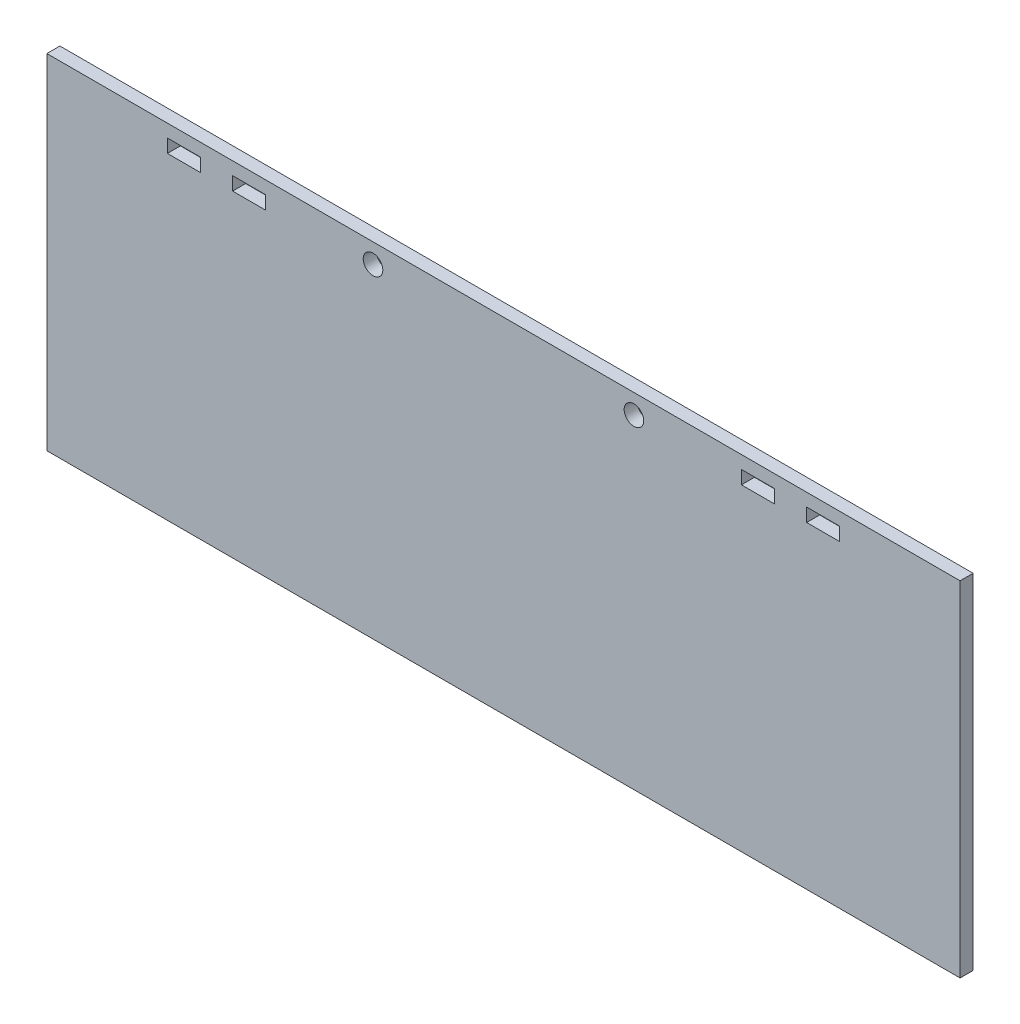
from build123d import *

# Parameters (mm, degrees)
SKETCH_1_R      = 1.5
SKETCH_1_W      = 5.05
SKETCH_1_H      = 2.05
EXTRUDE_1_DEPTH = 2


with BuildPart() as part:
    # 草图1 → 凸台-拉伸1 (new body)
    with BuildSketch(Plane.XY):
        Polygon((54.275, 1.975), (-15.725, 1.975), (-15.725, -50.760914608), (124.275, -50.760914608), (124.275, 1.975), align=None)
        with Locations((34.275, -1.025)):
            Circle(SKETCH_1_R, mode=Mode.SUBTRACT)
        with Locations((74.275, -1.025)):
            Circle(SKETCH_1_R, mode=Mode.SUBTRACT)
        with Locations((15.275, -1.025)):
            Rectangle(SKETCH_1_W, SKETCH_1_H, mode=Mode.SUBTRACT)
        with Locations((5.275, -1.025)):
            Rectangle(SKETCH_1_W, SKETCH_1_H, mode=Mode.SUBTRACT)
        with Locations((103.275, -1.025)):
            Rectangle(SKETCH_1_W, SKETCH_1_H, mode=Mode.SUBTRACT)
        with Locations((93.275, -1.025)):
            Rectangle(SKETCH_1_W, SKETCH_1_H, mode=Mode.SUBTRACT)
    extrude(amount=EXTRUDE_1_DEPTH)


solid = part.part
